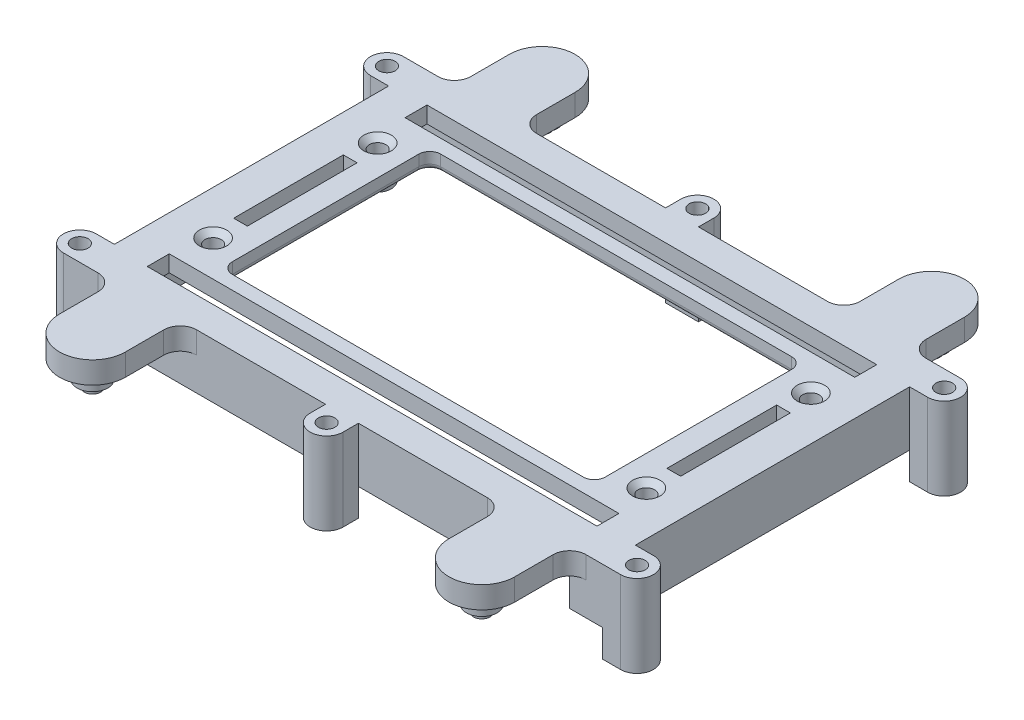
from build123d import *

# Parameters (mm, degrees)
SKETCH_1_R          = 1.5
EXTRUDE_1_DEPTH     = 15
CUT_EXTRUDE_START   = -11
CUT_EXTRUDE_1_DEPTH = 11
SKETCH_3_W          = 90
SKETCH_3_H          = 57
CUT_EXTRUDE_2_DEPTH = 12
SKETCH_4_R          = 2.8
EXTRUDE_2_DEPTH     = 3.3
EXTRUDE_2_2_DEPTH   = 3.3
EXTRUDE_2_3_DEPTH   = 3.3
EXTRUDE_2_4_DEPTH   = 3.3
SKETCH_5_R          = 1.5
EXTRUDE_3_DEPTH     = 1.3
EXTRUDE_3_2_DEPTH   = 1.3
EXTRUDE_3_3_DEPTH   = 1.3
EXTRUDE_3_4_DEPTH   = 1.3
SKETCH_6_W          = 95
SKETCH_6_H          = 62
CUT_EXTRUDE_3_DEPTH = 5
SKETCH_9_W          = 9.5
SKETCH_9_H          = 2.5
CUT_EXTRUDE_4_DEPTH = 5
CUT_EXTRUDE_5_DEPTH = 73.996164283
FILLET_1_R          = 3
FILLET_3_R          = 1
SKETCH_12_R         = 2.5
EXTRUDE_5_DEPTH     = 3
SKETCH_13_R         = 1.5
CUT_EXTRUDE_6_DEPTH = 73.003055491
CHAMFER_1_SIZE      = 1
SKETCH_15_W         = 82
SKETCH_15_H         = 4
SKETCH_15_W_2       = 2.5
SKETCH_15_H_2       = 20
CUT_EXTRUDE_8_DEPTH = 73.439215899


with BuildPart() as part:
    # 草图1 → 凸台-拉伸1 (new body)
    with BuildSketch(Plane(origin=(0, 0, 0), x_dir=(1, 0, 0), z_dir=(0, 1, 0))):
        with BuildLine():
            Line((-47.5, 31), (-41.5, 31))
            Line((-41.5, 31), (-41.5, 41))
            ThreePointArc((-41.5, 41), (-35.5, 47), (-29.5, 41))
            Line((-29.5, 41), (-29.5, 31))
            Line((-29.5, 31), (-3, 31))
            Line((-3, 31), (-3, 33.8))
            ThreePointArc((-3, 33.8), (0, 36.8), (3, 33.8))
            Line((3, 33.8), (3, 31))
            Line((3, 31), (29.5, 31))
            Line((29.5, 31), (29.5, 41))
            ThreePointArc((29.5, 41), (35.5, 47), (41.5, 41))
            Line((41.5, 41), (41.5, 31))
            Line((41.5, 31), (47.5, 31))
            Line((47.5, 31), (50.8, 31))
            ThreePointArc((50.8, 31), (53.8, 28), (50.8, 25))
            Line((50.8, 25), (47.5, 25))
            Line((47.5, 25), (47.5, -25))
            Line((47.5, -25), (50.8, -25))
            ThreePointArc((50.8, -25), (53.8, -28), (50.8, -31))
            Line((50.8, -31), (47.5, -31))
            Line((47.5, -31), (41.5, -31))
            Line((41.5, -31), (41.5, -41))
            ThreePointArc((41.5, -41), (35.5, -47), (29.5, -41))
            Line((29.5, -41), (29.5, -31))
            Line((29.5, -31), (3, -31))
            Line((3, -31), (3, -33.8))
            ThreePointArc((3, -33.8), (0, -36.8), (-3, -33.8))
            Line((-3, -33.8), (-3, -31))
            Line((-3, -31), (-29.5, -31))
            Line((-29.5, -31), (-29.5, -41))
            ThreePointArc((-29.5, -41), (-35.5, -47), (-41.5, -41))
            Line((-41.5, -41), (-41.5, -31))
            Line((-41.5, -31), (-47.5, -31))
            Line((-47.5, -31), (-50.8, -31))
            ThreePointArc((-50.8, -31), (-53.8, -28), (-50.8, -25))
            Line((-50.8, -25), (-47.5, -25))
            Line((-47.5, -25), (-47.5, 25))
            Line((-47.5, 25), (-50.8, 25))
            ThreePointArc((-50.8, 25), (-53.8, 28), (-50.8, 31))
            Line((-50.8, 31), (-47.5, 31))
        make_face()
        with Locations(Location((-50.8, 28, 0), (0, 0, 270))):
            Circle(SKETCH_1_R, mode=Mode.SUBTRACT)
        with Locations(Location((50.8, 28, 0), (0, 0, 90))):
            Circle(SKETCH_1_R, mode=Mode.SUBTRACT)
        with Locations(Location((50.8, -28, 0), (0, 0, 270))):
            Circle(SKETCH_1_R, mode=Mode.SUBTRACT)
        with Locations(Location((-50.8, -28, 0), (0, 0, 90))):
            Circle(SKETCH_1_R, mode=Mode.SUBTRACT)
        with Locations(Location((0, 33.8, 0), (0, 0, 270))):
            Circle(SKETCH_1_R, mode=Mode.SUBTRACT)
        with Locations(Location((0, -33.8, 0), (0, 0, 90))):
            Circle(SKETCH_1_R, mode=Mode.SUBTRACT)
    extrude(amount=-EXTRUDE_1_DEPTH)

    # 草图2 → 切除-拉伸1 (cut)
    with BuildSketch(Plane.XZ.offset(15).offset(CUT_EXTRUDE_START)):
        with BuildLine():
            Line((-57.023911512, 31), (-3, 31))
            Line((-3, 31), (-3, 33.8))
            ThreePointArc((-3, 33.8), (0, 36.8), (3, 33.8))
            Line((3, 33.8), (3, 31))
            Line((3, 31), (57.023911512, 31))
            Line((57.023911512, 31), (57.023911512, 48.5806389))
            Line((57.023911512, 48.5806389), (-57.023911512, 48.5806389))
            Line((-57.023911512, 48.5806389), (-57.023911512, 31))
        make_face()
        with BuildLine():
            Line((3, -33.8), (3, -31))
            Line((3, -31), (57.023911512, -31))
            Line((57.023911512, -31), (57.023911512, -48.5806389))
            Line((57.023911512, -48.5806389), (-57.023911512, -48.5806389))
            Line((-57.023911512, -48.5806389), (-57.023911512, -31))
            Line((-57.023911512, -31), (-3, -31))
            Line((-3, -31), (-3, -33.8))
            ThreePointArc((-3, -33.8), (0, -36.8), (3, -33.8))
        make_face()
    extrude(amount=CUT_EXTRUDE_1_DEPTH, mode=Mode.SUBTRACT)

    # 草图3 → 切除-拉伸2 (cut)
    with BuildSketch(Plane.XZ.offset(15)):
        Rectangle(SKETCH_3_W, SKETCH_3_H)
    extrude(amount=-CUT_EXTRUDE_2_DEPTH, mode=Mode.SUBTRACT)

    # 草图6 → 切除-拉伸3 (cut)
    with BuildSketch(Plane.XZ.offset(15)):
        Rectangle(SKETCH_6_W, SKETCH_6_H)
    extrude(amount=-CUT_EXTRUDE_3_DEPTH, mode=Mode.SUBTRACT)

    # 草图9 → 切除-拉伸4 (cut)
    with BuildSketch(Plane.XZ.offset(10)):
        with Locations((36.75, 29.75)):
            Rectangle(SKETCH_9_W, SKETCH_9_H)
    extrude(amount=-CUT_EXTRUDE_4_DEPTH, mode=Mode.SUBTRACT)

    # 草图10 → 切除-拉伸5 (cut, through all)
    with BuildSketch(Plane(origin=(0, 0, 0), x_dir=(1, 0, 0), z_dir=(0, 1, 0))):
        with BuildLine():
            Line((-32, -19), (32, -19))
            ThreePointArc((32, -19), (33.414213562, -18.414213562), (34, -17))
            Line((34, -17), (34, 17))
            ThreePointArc((34, 17), (33.414213562, 18.414213562), (32, 19))
            Line((32, 19), (-32, 19))
            ThreePointArc((-32, 19), (-33.414213562, 18.414213562), (-34, 17))
            Line((-34, 17), (-34, -17))
            ThreePointArc((-34, -17), (-33.414213562, -18.414213562), (-32, -19))
        make_face()
    extrude(amount=-CUT_EXTRUDE_5_DEPTH, mode=Mode.SUBTRACT)

    # 圆角1
    fillet_1_edges = [part.edges().sort_by_distance(p)[0] for p in [
        (41.5, -2, -31),
        (29.5, -2, -31),
        (-29.5, -2, -31),
        (-41.5, -2, -31),
        (-41.5, -2, 31),
        (-29.5, -2, 31),
        (29.5, -2, 31),
        (41.5, -2, 31),
    ]]
    fillet(fillet_1_edges, radius=FILLET_1_R)

    # 圆角3
    fillet_3_edges = [part.edges().sort_by_distance(p)[0] for p in [
        (45, -3, 0),
        (0, -3, -28.5),
        (-45, -3, 0),
        (0, -3, 28.5),
        (0, -3, 19),
        (33.414213562, -3, 18.414213562),
        (34, -3, 0),
        (33.414213562, -3, -18.414213562),
        (0, -3, -19),
        (-33.414213562, -3, -18.414213562),
        (-34, -3, 0),
        (-33.414213562, -3, 18.414213562),
    ]]
    fillet(fillet_3_edges, radius=FILLET_3_R)


with BuildPart() as body_2:
    # 草图4 → 凸台-拉伸2 (new body)
    with BuildSketch(Plane.XZ.offset(4)):
        with Locations(Location((-35.5, 41, 0), (0, 0, 270))):
            Circle(SKETCH_4_R)
    extrude(amount=EXTRUDE_2_DEPTH)


with BuildPart() as body_3:
    # 草图4 → Extrude 2 2 (new body)
    with BuildSketch(Plane.XZ.offset(4)):
        with Locations(Location((35.5, 41, 0), (0, 0, 90))):
            Circle(SKETCH_4_R)
    extrude(amount=EXTRUDE_2_2_DEPTH)


with BuildPart() as body_4:
    # 草图4 → Extrude 2 3 (new body)
    with BuildSketch(Plane.XZ.offset(4)):
        with Locations(Location((35.5, -41, 0), (0, 0, 270))):
            Circle(SKETCH_4_R)
    extrude(amount=EXTRUDE_2_3_DEPTH)


with BuildPart() as body_5:
    # 草图4 → Extrude 2 4 (new body)
    with BuildSketch(Plane.XZ.offset(4)):
        with Locations(Location((-35.5, -41, 0), (0, 0, 90))):
            Circle(SKETCH_4_R)
    extrude(amount=EXTRUDE_2_4_DEPTH)


with BuildPart() as body_6:
    # 草图5 → 凸台-拉伸3 (new body)
    with BuildSketch(Plane.XZ.offset(7.3)):
        with Locations(Location((-35.5, 41, 0), (0, 0, 270))):
            Circle(SKETCH_5_R)
    extrude(amount=EXTRUDE_3_DEPTH)


with BuildPart() as body_7:
    # 草图5 → Extrude 3 2 (new body)
    with BuildSketch(Plane.XZ.offset(7.3)):
        with Locations(Location((35.5, 41, 0), (0, 0, 90))):
            Circle(SKETCH_5_R)
    extrude(amount=EXTRUDE_3_2_DEPTH)


with BuildPart() as body_8:
    # 草图5 → Extrude 3 3 (new body)
    with BuildSketch(Plane.XZ.offset(7.3)):
        with Locations(Location((35.5, -41, 0), (0, 0, 270))):
            Circle(SKETCH_5_R)
    extrude(amount=EXTRUDE_3_3_DEPTH)


with BuildPart() as body_9:
    # 草图5 → Extrude 3 4 (new body)
    with BuildSketch(Plane.XZ.offset(7.3)):
        with Locations(Location((-35.5, -41, 0), (0, 0, 90))):
            Circle(SKETCH_5_R)
    extrude(amount=EXTRUDE_3_4_DEPTH)


with BuildPart() as body_4_1:
    add(body_4.part)

    # Combine 1: union part, body 8, body 2, body 5, body 6, body 9, body 3, body 7
    add(part.part)
    add(body_8.part)
    add(body_2.part)
    add(body_5.part)
    add(body_6.part)
    add(body_9.part)
    add(body_3.part)
    add(body_7.part)

    # 草图12 → 凸台-拉伸5 (add)
    with BuildSketch(Plane.XZ.offset(3)):
        with Locations(Location((-39.5, 15, 0), (0, 0, 90))):
            Circle(SKETCH_12_R)
        with Locations(Location((-39.5, -15, 0), (0, 0, 90))):
            Circle(SKETCH_12_R)
        with Locations(Location((39.5, -15, 0), (0, 0, 90))):
            Circle(SKETCH_12_R)
        with Locations(Location((39.5, 15, 0), (0, 0, 90))):
            Circle(SKETCH_12_R)
    extrude(amount=EXTRUDE_5_DEPTH)

    # 草图13 → 切除-拉伸6 (cut, through all)
    with BuildSketch(Plane.XZ.offset(6)):
        with Locations(Location((39.5, -15, 0), (0, 0, 270))):
            Circle(SKETCH_13_R)
        with Locations(Location((39.5, 15, 0), (0, 0, 270))):
            Circle(SKETCH_13_R)
        with Locations(Location((-39.5, -15, 0), (0, 0, 270))):
            Circle(SKETCH_13_R)
        with Locations(Location((-39.5, 15, 0), (0, 0, 270))):
            Circle(SKETCH_13_R)
    extrude(amount=-CUT_EXTRUDE_6_DEPTH, mode=Mode.SUBTRACT)

    # 倒角1
    chamfer_1_edges = [body_4_1.edges().sort_by_distance(p)[0] for p in [
        (39.5, 0, 16.5),
        (-39.5, 0, -13.5),
        (-39.5, 0, 16.5),
        (39.5, 0, -13.5),
    ]]
    chamfer(chamfer_1_edges, length=CHAMFER_1_SIZE)

    # 草图15 → 切除-拉伸8 (cut, through all)
    with BuildSketch(Plane.XZ.offset(3)):
        with Locations((0, 23.5)):
            Rectangle(SKETCH_15_W, SKETCH_15_H)
        with Locations((0, -23.5)):
            Rectangle(SKETCH_15_W, SKETCH_15_H)
        with Locations((-39.5, 0)):
            Rectangle(SKETCH_15_W_2, SKETCH_15_H_2)
        with Locations((39.5, 0)):
            Rectangle(SKETCH_15_W_2, SKETCH_15_H_2)
    extrude(amount=-CUT_EXTRUDE_8_DEPTH, mode=Mode.SUBTRACT)


solid = body_4_1.part
